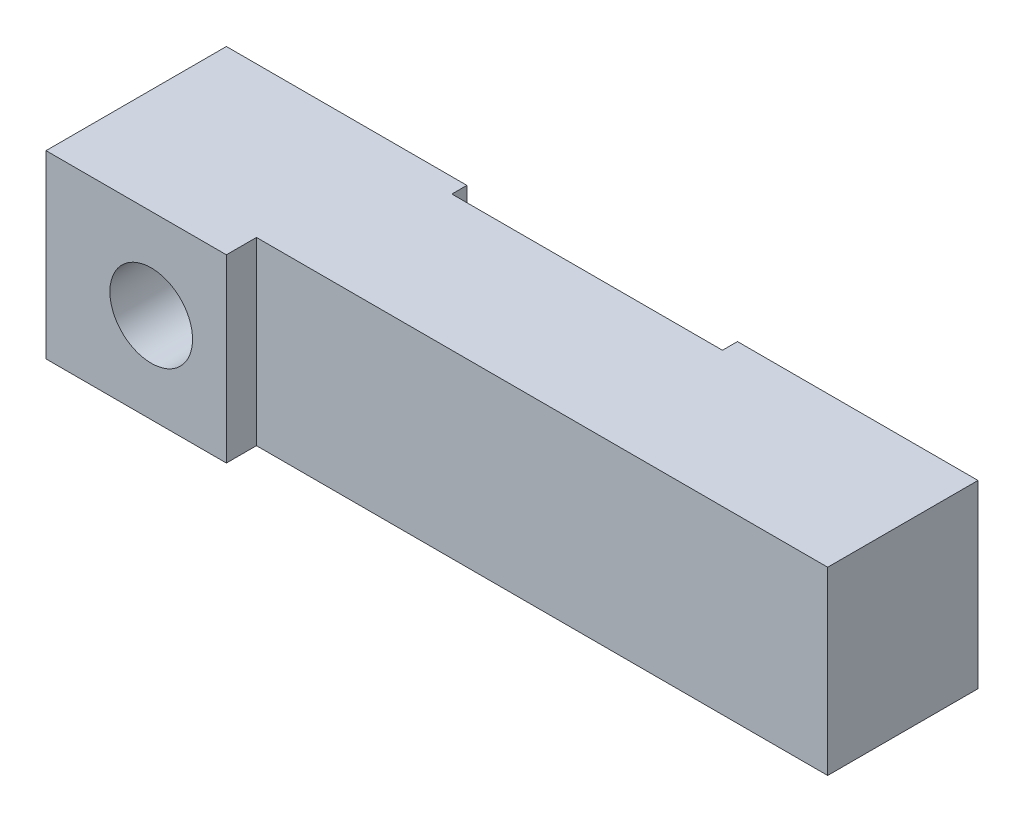
from build123d import *

# Parameters (mm, degrees)
ESQUISSE1_W                                        = 50
ESQUISSE1_H                                        = 12
BOSS_EXTRU_1_DEPTH                                 = 10
ESQUISSE3_W                                        = 12
ESQUISSE3_H                                        = 12
BOSS_EXTRU_2_DEPTH                                 = 2
ENL_V_MAT_EXTRU_3_DEPTH                            = 29.372521918
ENL_V_MAT_EXTRU_3_DEPTH_BACK                       = 29.372521918
ESQUISSE4_W                                        = 18
ESQUISSE4_H                                        = 3.498401272
CHAMBRAGE_POUR_VIS_T_TE_HEXAGONALE_M52_D           = 5.5
CHAMBRAGE_POUR_VIS_T_TE_HEXAGONALE_M52_CBORE_D     = 10
CHAMBRAGE_POUR_VIS_T_TE_HEXAGONALE_M52_CBORE_DEPTH = 5.4


with BuildPart() as part:
    # Esquisse1 → Boss.-Extru.1 (new body)
    with BuildSketch(Plane.XY):
        Rectangle(ESQUISSE1_W, ESQUISSE1_H)
    extrude(amount=BOSS_EXTRU_1_DEPTH)

    # Esquisse3 → Boss.-Extru.2 (add)
    with BuildSketch(Plane.XY.offset(10)):
        with Locations((-19, 0)):
            Rectangle(ESQUISSE3_W, ESQUISSE3_H)
    extrude(amount=BOSS_EXTRU_2_DEPTH)

    # Esquisse4 → Enlèv. mat.-Extru.3 (cut, two sides: drawn at the far end of the back side and taken through both)
    with BuildSketch(Plane(origin=(0, 0, 0), x_dir=(1, 0, 0), z_dir=(0, 1, 0)).offset(-ENL_V_MAT_EXTRU_3_DEPTH_BACK)):
        with Locations((0, 0.749200636)):
            Rectangle(ESQUISSE4_W, ESQUISSE4_H)
    extrude(amount=ENL_V_MAT_EXTRU_3_DEPTH + ENL_V_MAT_EXTRU_3_DEPTH_BACK, mode=Mode.SUBTRACT)

    # Chambrage pour vis à tête hexagonale M52 (through all)
    with Locations(Plane(origin=(0, 0, 0), x_dir=(-1, 0, 0), z_dir=(0, 0, -1))):
        with Locations((18, 0)):
            CounterBoreHole(CHAMBRAGE_POUR_VIS_T_TE_HEXAGONALE_M52_D / 2, CHAMBRAGE_POUR_VIS_T_TE_HEXAGONALE_M52_CBORE_D / 2, CHAMBRAGE_POUR_VIS_T_TE_HEXAGONALE_M52_CBORE_DEPTH)


solid = part.part
